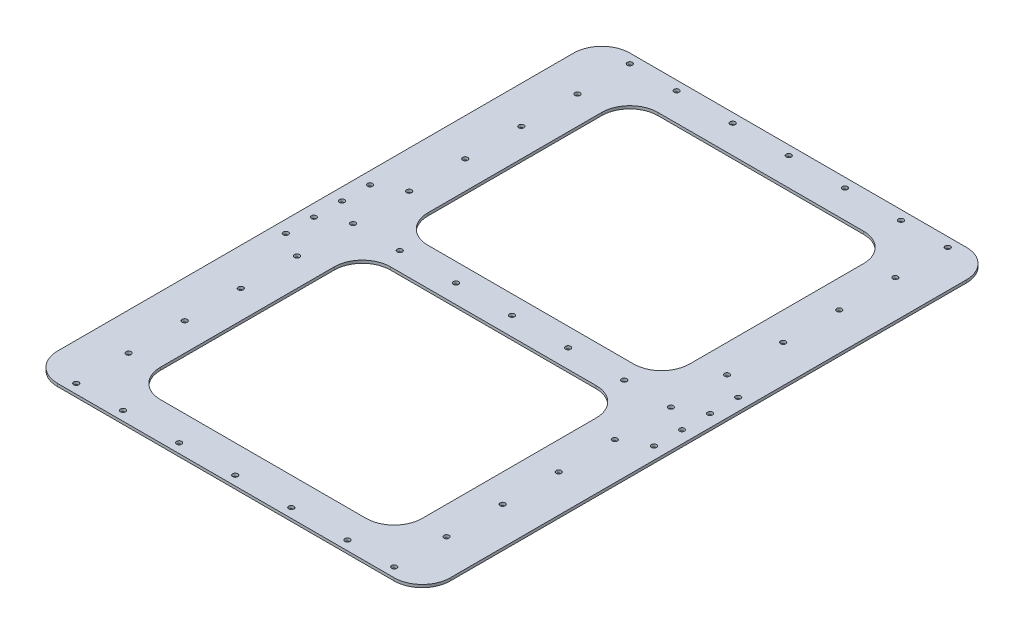
from build123d import *

# Parameters (mm, degrees)
SKETCH1_W               = 420
SKETCH1_H               = 612
BOSS_EXTRUDE1_DEPTH     = 3
SKETCH_1_R              = 2.75
CUT_EXTRUDE_1_DEPTH     = 372.140135259
CUT_EXTRUDE1_DEPTH      = 372.140135259
CUT_EXTRUDE1_DEPTH_BACK = 372.140135259
SKETCH2_W               = 280
SKETCH2_H               = 246
FILLET1_R               = 30
FILLET2_R               = 30


with BuildPart() as part:
    # Sketch1 → Boss-Extrude1 (new body)
    with BuildSketch(Plane(origin=(0, 0, 0), x_dir=(1, 0, 0), z_dir=(0, 1, 0))):
        Rectangle(SKETCH1_W, SKETCH1_H)
    extrude(amount=BOSS_EXTRUDE1_DEPTH)

    # 草图1 → 切除-拉伸1 (cut, through all)
    with BuildSketch(Plane(origin=(0, 3, 0), x_dir=(1, 0, 0), z_dir=(0, 1, 0))):
        with Locations(Location((-170, 240, 0), (0, 0, 270))):
            Circle(SKETCH_1_R)
        with Locations(Location((-170, 180, 0), (0, 0, 270))):
            Circle(SKETCH_1_R)
        with Locations(Location((-196.85, -15, 0), (0, 0, 270))):
            Circle(SKETCH_1_R)
        with Locations(Location((-196.85, -45, 0), (0, 0, 270))):
            Circle(SKETCH_1_R)
        with Locations(Location((-196.85, 45, 0), (0, 0, 90))):
            Circle(SKETCH_1_R)
        with Locations(Location((-196.85, 15, 0), (0, 0, 90))):
            Circle(SKETCH_1_R)
        with Locations(Location((196.85, 15, 0), (0, 0, 270))):
            Circle(SKETCH_1_R)
        with Locations(Location((196.85, 45, 0), (0, 0, 270))):
            Circle(SKETCH_1_R)
        with Locations(Location((196.85, -45, 0), (0, 0, 90))):
            Circle(SKETCH_1_R)
        with Locations(Location((196.85, -15, 0), (0, 0, 90))):
            Circle(SKETCH_1_R)
        with Locations(Location((0, 0, 0), (0, 0, 270))):
            Circle(SKETCH_1_R)
        with Locations(Location((-60, 0, 0), (0, 0, 270))):
            Circle(SKETCH_1_R)
        with Locations(Location((-120, 0, 0), (0, 0, 270))):
            Circle(SKETCH_1_R)
        with Locations(Location((60, 0, 0), (0, 0, 90))):
            Circle(SKETCH_1_R)
        with Locations(Location((120, 0, 0), (0, 0, 90))):
            Circle(SKETCH_1_R)
        with Locations(Location((0, 296, 0), (0, 0, 270))):
            Circle(SKETCH_1_R)
        with Locations(Location((-60, 296, 0), (0, 0, 270))):
            Circle(SKETCH_1_R)
        with Locations(Location((-120, 296, 0), (0, 0, 270))):
            Circle(SKETCH_1_R)
        with Locations(Location((-170, 296, 0), (0, 0, 270))):
            Circle(SKETCH_1_R)
        with Locations(Location((170, 296, 0), (0, 0, 90))):
            Circle(SKETCH_1_R)
        with Locations(Location((-170, 120, 0), (0, 0, 270))):
            Circle(SKETCH_1_R)
        with Locations(Location((-170, 60, 0), (0, 0, 270))):
            Circle(SKETCH_1_R)
        with Locations(Location((-170, 0, 0), (0, 0, 270))):
            Circle(SKETCH_1_R)
        with Locations(Location((-170, -60, 0), (0, 0, 270))):
            Circle(SKETCH_1_R)
        with Locations(Location((-170, -120, 0), (0, 0, 270))):
            Circle(SKETCH_1_R)
        with Locations(Location((-170, -180, 0), (0, 0, 270))):
            Circle(SKETCH_1_R)
        with Locations(Location((-170, -240, 0), (0, 0, 270))):
            Circle(SKETCH_1_R)
        with Locations(Location((170, -240, 0), (0, 0, 90))):
            Circle(SKETCH_1_R)
        with Locations(Location((170, -180, 0), (0, 0, 90))):
            Circle(SKETCH_1_R)
        with Locations(Location((170, -120, 0), (0, 0, 90))):
            Circle(SKETCH_1_R)
        with Locations(Location((170, -60, 0), (0, 0, 90))):
            Circle(SKETCH_1_R)
        with Locations(Location((170, 0, 0), (0, 0, 90))):
            Circle(SKETCH_1_R)
        with Locations(Location((170, 60, 0), (0, 0, 90))):
            Circle(SKETCH_1_R)
        with Locations(Location((170, 120, 0), (0, 0, 90))):
            Circle(SKETCH_1_R)
        with Locations(Location((170, 180, 0), (0, 0, 90))):
            Circle(SKETCH_1_R)
        with Locations(Location((170, 240, 0), (0, 0, 90))):
            Circle(SKETCH_1_R)
        with Locations(Location((60, 296, 0), (0, 0, 90))):
            Circle(SKETCH_1_R)
        with Locations(Location((120, 296, 0), (0, 0, 90))):
            Circle(SKETCH_1_R)
        with Locations(Location((120, -296, 0), (0, 0, 270))):
            Circle(SKETCH_1_R)
        with Locations(Location((60, -296, 0), (0, 0, 270))):
            Circle(SKETCH_1_R)
        with Locations(Location((170, -296, 0), (0, 0, 270))):
            Circle(SKETCH_1_R)
        with Locations(Location((-170, -296, 0), (0, 0, 90))):
            Circle(SKETCH_1_R)
        with Locations(Location((-120, -296, 0), (0, 0, 90))):
            Circle(SKETCH_1_R)
        with Locations(Location((-60, -296, 0), (0, 0, 90))):
            Circle(SKETCH_1_R)
        with Locations(Location((0, -296, 0), (0, 0, 90))):
            Circle(SKETCH_1_R)
    extrude(amount=-CUT_EXTRUDE_1_DEPTH, mode=Mode.SUBTRACT)

    # Sketch2 → Cut-Extrude1 (cut, two sides: drawn at the far end of the back side and taken through both)
    with BuildSketch(Plane(origin=(0, 3, 0), x_dir=(1, 0, 0), z_dir=(0, 1, 0)).offset(-CUT_EXTRUDE1_DEPTH_BACK)):
        with Locations((0, 143)):
            Rectangle(SKETCH2_W, SKETCH2_H)
        with Locations((0, -143)):
            Rectangle(SKETCH2_W, SKETCH2_H)
    extrude(amount=CUT_EXTRUDE1_DEPTH + CUT_EXTRUDE1_DEPTH_BACK, mode=Mode.SUBTRACT)

    # Fillet1
    fillet1_edges = [part.edges().sort_by_distance(p)[0] for p in [
        (140, 1.5, -266),
        (140, 1.5, -20),
        (-140, 1.5, -20),
        (-140, 1.5, -266),
        (-140, 1.5, 266),
        (-140, 1.5, 20),
        (140, 1.5, 20),
        (140, 1.5, 266),
    ]]
    fillet(fillet1_edges, radius=FILLET1_R)

    # Fillet2
    fillet2_edges = [part.edges().sort_by_distance(p)[0] for p in [
        (210, 1.5, 306),
        (-210, 1.5, 306),
        (-210, 1.5, -306),
        (210, 1.5, -306),
    ]]
    fillet(fillet2_edges, radius=FILLET2_R)


solid = part.part
